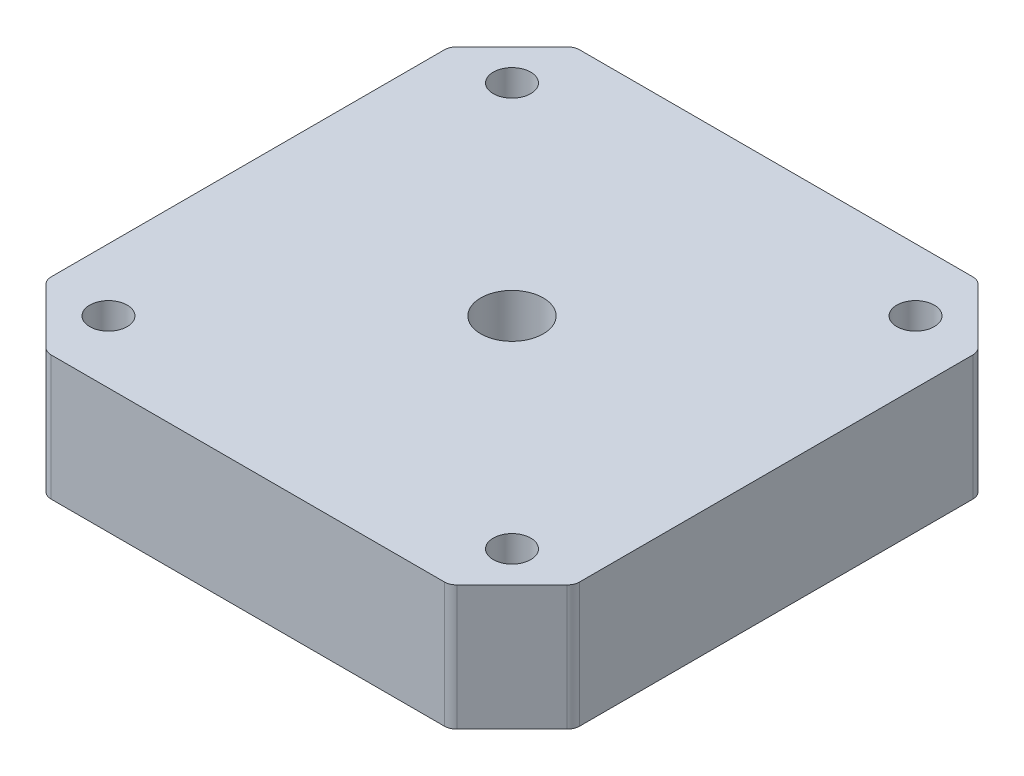
from build123d import *

# Parameters (mm, degrees)
SKETCH1_R           = 1.5
BOSS_EXTRUDE1_DEPTH = 10
FILLET1_R           = 1
FILLET2_R           = 1
FILLET3_R           = 1
FILLET4_R           = 1
FILLET5_R           = 1
FILLET6_R           = 1
FILLET7_R           = 1
FILLET8_R           = 1
SKETCH2_R           = 12.5
BOSS_EXTRUDE2_DEPTH = 2
SKETCH4_R           = 2.5
CUT_EXTRUDE1_DEPTH  = 10
SKETCH5_R           = 2.5
CUT_EXTRUDE2_DEPTH  = 50


with BuildPart() as part:
    # Sketch1 → Boss-Extrude1 (new body)
    with BuildSketch(Plane(origin=(0, 0, 0), x_dir=(1, 0, 0), z_dir=(0, 1, 0))):
        Polygon((37.3, 42.3), (5, 42.3), (0, 37.3), (0, 5), (5, 0), (37.3, 0), (42.3, 5), (42.3, 37.3), align=None)
        with Locations(Location((5, 5, 0), (0, 0, 270))):
            Circle(SKETCH1_R, mode=Mode.SUBTRACT)
        with Locations(Location((37.3, 5, 0), (0, 0, 270))):
            Circle(SKETCH1_R, mode=Mode.SUBTRACT)
        with Locations(Location((5, 37.3, 0), (0, 0, 270))):
            Circle(SKETCH1_R, mode=Mode.SUBTRACT)
        with Locations(Location((37.3, 37.3, 0), (0, 0, 270))):
            Circle(SKETCH1_R, mode=Mode.SUBTRACT)
    extrude(amount=BOSS_EXTRUDE1_DEPTH)

    # Fillet1
    fillet1_edges = [part.edges().sort_by_distance(p)[0] for p in [
        (0, 5, -5),
    ]]
    fillet(fillet1_edges, radius=FILLET1_R)

    # Fillet2
    fillet2_edges = [part.edges().sort_by_distance(p)[0] for p in [
        (5, 5, 0),
    ]]
    fillet(fillet2_edges, radius=FILLET2_R)

    # Fillet3
    fillet3_edges = [part.edges().sort_by_distance(p)[0] for p in [
        (37.3, 5, 0),
    ]]
    fillet(fillet3_edges, radius=FILLET3_R)

    # Fillet4
    fillet4_edges = [part.edges().sort_by_distance(p)[0] for p in [
        (42.3, 5, -5),
    ]]
    fillet(fillet4_edges, radius=FILLET4_R)

    # Fillet5
    fillet5_edges = [part.edges().sort_by_distance(p)[0] for p in [
        (42.3, 5, -37.3),
    ]]
    fillet(fillet5_edges, radius=FILLET5_R)

    # Fillet6
    fillet6_edges = [part.edges().sort_by_distance(p)[0] for p in [
        (37.3, 5, -42.3),
    ]]
    fillet(fillet6_edges, radius=FILLET6_R)

    # Fillet7
    fillet7_edges = [part.edges().sort_by_distance(p)[0] for p in [
        (5, 5, -42.3),
    ]]
    fillet(fillet7_edges, radius=FILLET7_R)

    # Fillet8
    fillet8_edges = [part.edges().sort_by_distance(p)[0] for p in [
        (0, 5, -37.3),
    ]]
    fillet(fillet8_edges, radius=FILLET8_R)

    # Sketch2 → Boss-Extrude2 (add)
    with BuildSketch(Plane.XZ):
        with Locations(Location((21.15, -21.15, 0), (0, 0, 90))):
            Circle(SKETCH2_R)
    extrude(amount=BOSS_EXTRUDE2_DEPTH)

    # Sketch4 → Cut-Extrude1 (cut)
    with BuildSketch(Plane.XZ.offset(2)):
        with Locations(Location((21.15, -21.15, 0), (0, 0, 270))):
            Circle(SKETCH4_R)
    extrude(amount=-CUT_EXTRUDE1_DEPTH, mode=Mode.SUBTRACT)

    # Sketch5 → Cut-Extrude2 (cut)
    with BuildSketch(Plane.XZ.offset(2)):
        with Locations(Location((21.15, -21.15, 0), (0, 0, 270))):
            Circle(SKETCH5_R)
    extrude(amount=-CUT_EXTRUDE2_DEPTH, mode=Mode.SUBTRACT)


solid = part.part
